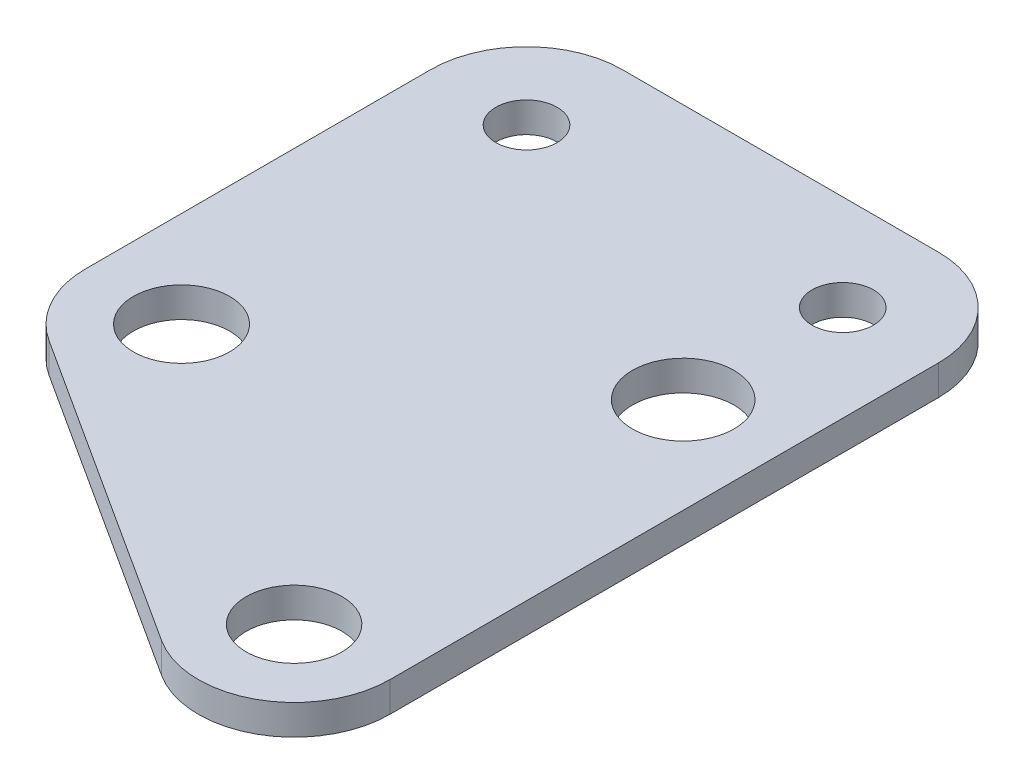
from build123d import *

# Parameters (mm, degrees)
SKETCH1_R           = 2.51
SKETCH1_R_2         = 2.5
SKETCH1_R_3         = 1.6
SKETCH1_R_4         = 2.65
BOSS_EXTRUDE1_DEPTH = 1.57
FILLET1_R           = 5


with BuildPart() as part:
    # Sketch1 → Boss-Extrude1 (new body)
    with BuildSketch(Plane(origin=(0, 0, 0), x_dir=(1, 0, 0), z_dir=(0, 1, 0))):
        Polygon((0, 0), (26.5, 0), (26.5, -42.791666667), (0, -25.727272727), align=None)
        with Locations(Location((5, -23, 0), (0, 0, 270))):
            Circle(SKETCH1_R, mode=Mode.SUBTRACT)
        with Locations(Location((21.5, -33.625, 0), (0, 0, 270))):
            Circle(SKETCH1_R_2, mode=Mode.SUBTRACT)
        with Locations(Location((21.5, -5, 0), (0, 0, 270))):
            Circle(SKETCH1_R_3, mode=Mode.SUBTRACT)
        with Locations(Location((5, -5, 0), (0, 0, 270))):
            Circle(SKETCH1_R_3, mode=Mode.SUBTRACT)
        with Locations(Location((21.5, -13.325, 0), (0, 0, 270))):
            Circle(SKETCH1_R_4, mode=Mode.SUBTRACT)
    extrude(amount=BOSS_EXTRUDE1_DEPTH)

    # Fillet1
    fillet1_edges = [part.edges().sort_by_distance(p)[0] for p in [
        (0, 0.785, 0),
        (26.5, 0.785, 0),
        (26.5, 0.785, 42.791666667),
        (0, 0.785, 25.727272727),
    ]]
    fillet(fillet1_edges, radius=FILLET1_R)


solid = part.part
